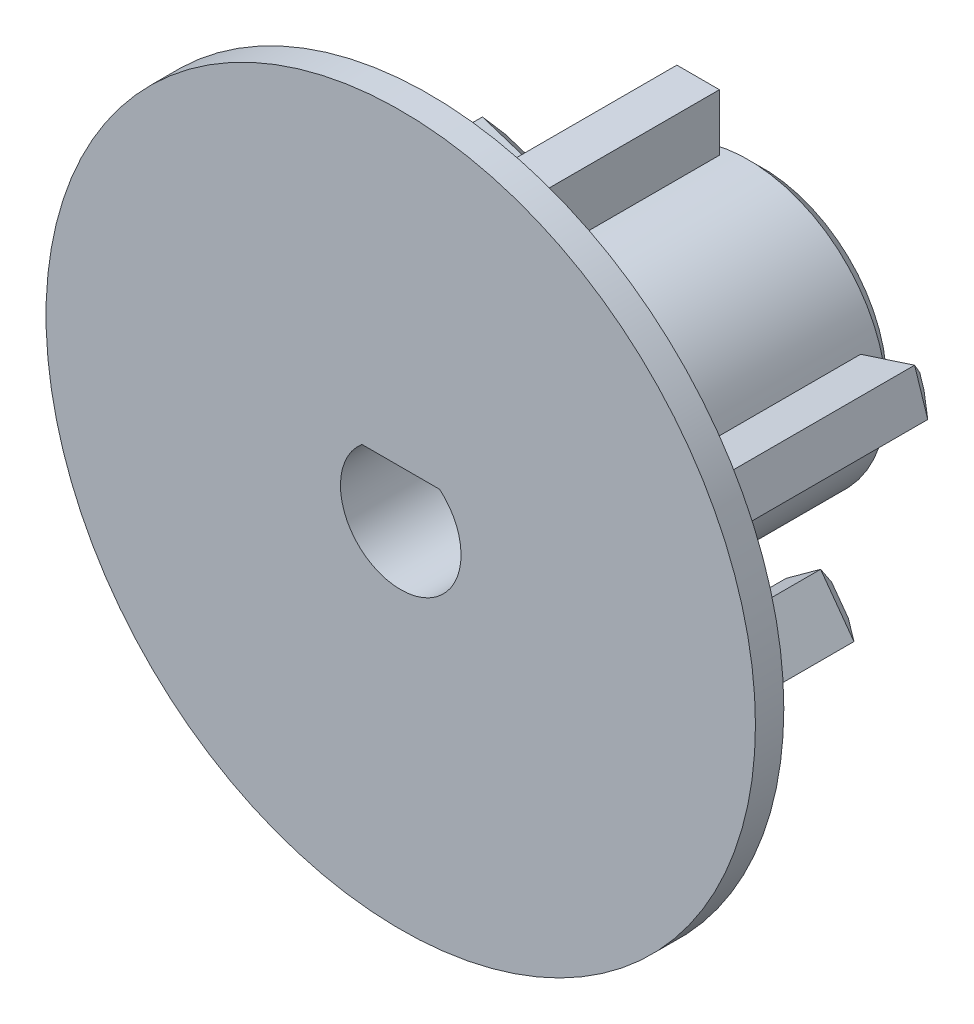
from build123d import *

# Parameters (mm, degrees)
ESQUISSE3_R             = 25
BOSS_EXTRU_2_DEPTH      = 2
ESQUISSE5_R             = 9.75
ESQUISSE5_W             = 3
ESQUISSE5_H             = 4
BOSS_EXTRU_3_DEPTH      = 20
ENL_V_MAT_EXTRU_1_DEPTH = 22
ESQUISSE7_R             = 9.75
BOSS_EXTRU_4_DEPTH      = 3.5
ESQUISSE8_R             = 1.25
ENL_V_MAT_EXTRU_2_DEPTH = 44.591857038
CHANFREIN3_SIZE         = 1
CHANFREIN4_SIZE         = 1
CHANFREIN5_SIZE         = 0.5


with BuildPart() as part:
    # Esquisse3 → Boss.-Extru.2 (new body)
    with BuildSketch(Plane.XY):
        Circle(ESQUISSE3_R)
    extrude(amount=BOSS_EXTRU_2_DEPTH)

    # Esquisse5 → Boss.-Extru.3 (add)
    with BuildSketch(Plane(origin=(0, 0, 0), x_dir=(-1, 0, 0), z_dir=(0, 0, -1))):
        with Locations(Location((0, 0, 0), (0, 0, 180))):
            Circle(ESQUISSE5_R)
        Polygon((-15.216843748, 6.562492138), (-11.412617683, 5.326424161), (-12.339668666, 2.473254612), (-16.143894731, 3.709322589), align=None)
        with Locations((0.039037592, 14.5)):
            Rectangle(ESQUISSE5_W, ESQUISSE5_H)
        Polygon((15.240970307, 6.488238225), (16.16802129, 3.635068676), (12.363795225, 2.399000699), (11.436744242, 5.252170247), align=None)
        Polygon((10.880400079, -12.49004825), (8.453349096, -14.253404007), (6.102208086, -11.017336029), (8.52925907, -9.253980272), align=None)
        Polygon((-8.516513247, -14.207512565), (-10.94356423, -12.444156808), (-8.592423221, -9.20808883), (-6.165372238, -10.971444587), align=None)
    extrude(amount=BOSS_EXTRU_3_DEPTH)

    # Esquisse6 → Enlèv. mat.-Extru.1 (cut)
    with BuildSketch(Plane.XY.offset(2)):
        with BuildLine():
            Line((-2.738612788, 3.25), (2.738612788, 3.25))
            ThreePointArc((2.738612788, 3.25), (0, -4.25), (-2.738612788, 3.25))
        make_face()
    extrude(amount=-ENL_V_MAT_EXTRU_1_DEPTH, mode=Mode.SUBTRACT)

    # Esquisse7 → Boss.-Extru.4 (add)
    with BuildSketch(Plane(origin=(0, 0, -20), x_dir=(-1, 0, 0), z_dir=(0, 0, -1))):
        with Locations(Location((0, 0, 0), (0, 0, 180))):
            Circle(ESQUISSE7_R)
    extrude(amount=BOSS_EXTRU_4_DEPTH)

    # Esquisse8 → Enlèv. mat.-Extru.2 (cut, through all)
    with BuildSketch(Plane(origin=(0, 0, -23.5), x_dir=(-1, 0, 0), z_dir=(0, 0, -1))):
        Circle(ESQUISSE8_R)
    extrude(amount=-ENL_V_MAT_EXTRU_2_DEPTH, mode=Mode.SUBTRACT)

    # Chanfrein3
    chanfrein3_edges = [part.edges().sort_by_distance(p)[0] for p in [
        (14.241781698, 3.091288601, -20),
        (11.876143174, 3.899839386, -20),
        (13.314730715, 5.94445815, -20),
        (15.680369239, 5.135907364, -20),
    ]]
    chamfer(chanfrein3_edges, length=CHANFREIN3_SIZE)

    # Chanfrein4
    chanfrein4_edges = [part.edges().sort_by_distance(p)[0] for p in [
        (-1.539037592, 14.5, -20),
        (-0.039037592, 16.5, -20),
        (1.460962408, 14.5, -20),
        (-0.039037592, 12.5, -20),
        (-14.265908257, 3.017034687, -20),
        (-15.704495798, 5.061653451, -20),
        (-13.338857274, 5.870204236, -20),
        (-11.900269733, 3.825585473, -20),
        (-7.277778591, -12.635370018, -20),
        (-9.666874587, -13.371726128, -20),
        (-9.704829574, -10.872014261, -20),
        (-7.315733578, -10.135658151, -20),
        (9.767993725, -10.826122819, -20),
        (9.730038739, -13.325834686, -20),
        (7.340942742, -12.589478576, -20),
        (7.378897729, -10.089766709, -20),
        (-9.75, 0, -23.5),
    ]]
    chamfer(chanfrein4_edges, length=CHANFREIN4_SIZE)

    # Chanfrein5
    chanfrein5_edges = [part.edges().sort_by_distance(p)[0] for p in [
        (1.25, 0, -20),
    ]]
    chamfer(chanfrein5_edges, length=CHANFREIN5_SIZE)


solid = part.part
